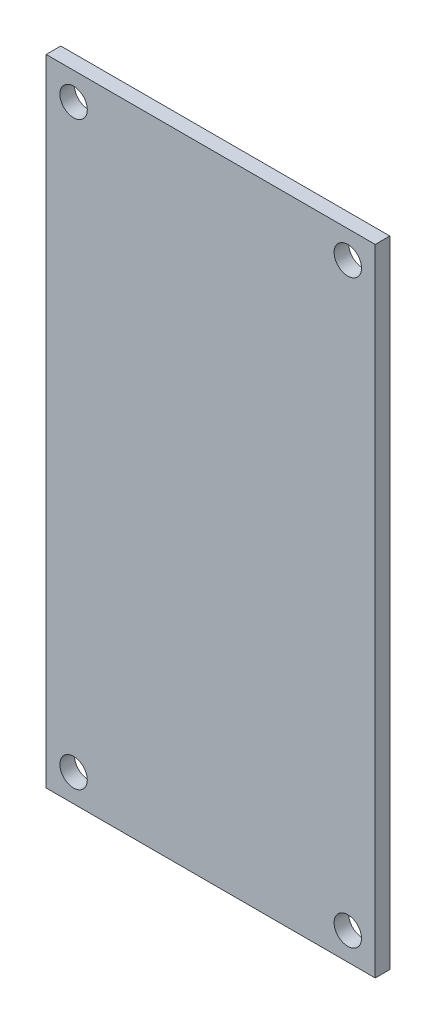
from build123d import *

# Parameters (mm, degrees)
SKETCH1_W           = 36
SKETCH1_H           = 69.5
SKETCH1_R           = 1.5
BOSS_EXTRUDE1_DEPTH = 1.6


with BuildPart() as part:
    # Sketch1 → Boss-Extrude1 (new body)
    with BuildSketch(Plane.XY):
        with Locations((18, 34.75)):
            Rectangle(SKETCH1_W, SKETCH1_H)
        with Locations((3, 66.5)):
            Circle(SKETCH1_R, mode=Mode.SUBTRACT)
        with Locations((33, 66.5)):
            Circle(SKETCH1_R, mode=Mode.SUBTRACT)
        with Locations((33, 3)):
            Circle(SKETCH1_R, mode=Mode.SUBTRACT)
        with Locations((3, 3)):
            Circle(SKETCH1_R, mode=Mode.SUBTRACT)
    extrude(amount=BOSS_EXTRUDE1_DEPTH)


solid = part.part
